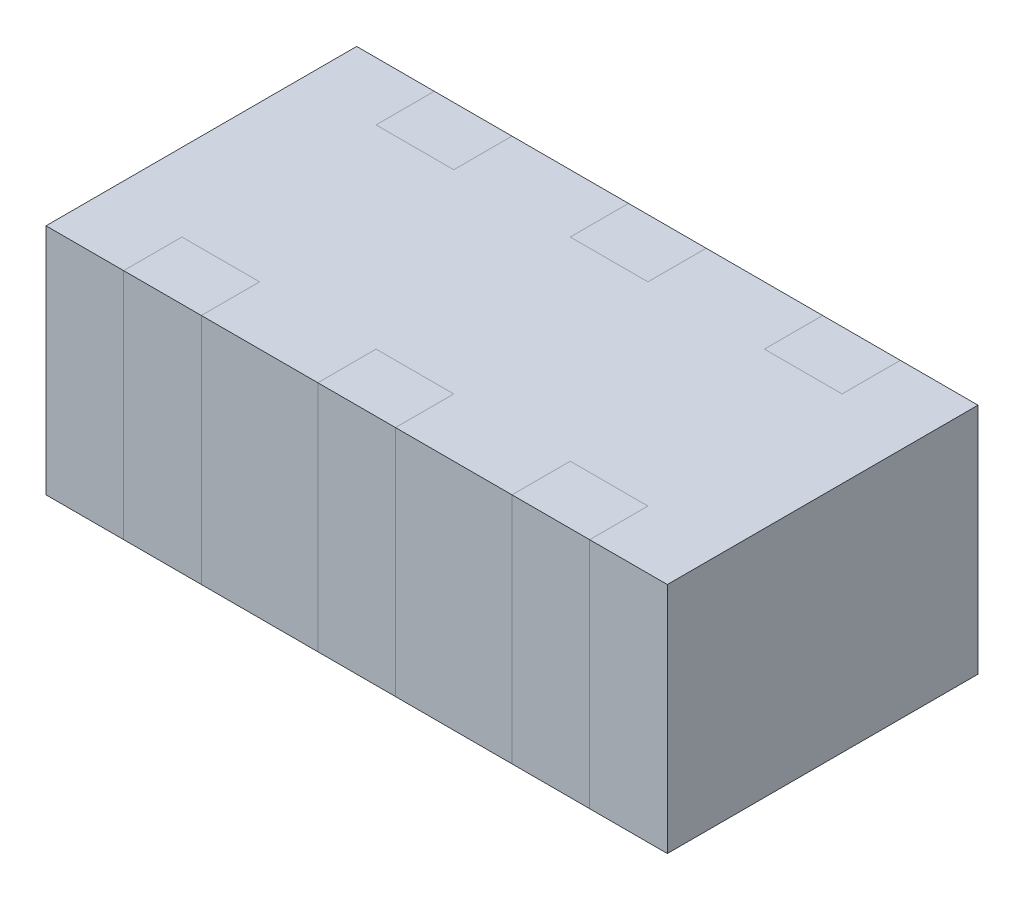
from build123d import *

# Parameters (mm, degrees)
SKETCH1_W             = 1.6
SKETCH1_H             = 0.8
BOSS_EXTRUDE1_DEPTH   = 0.6
SKETCH2_W             = 0.2
SKETCH2_H             = 0.15
CUT_EXTRUDE1_DEPTH    = 0.6
SKETCH2_2_W           = 0.2
SKETCH2_2_H           = 0.15
BOSS_EXTRUDE2_DEPTH   = 0.6
BOSS_EXTRUDE2_2_DEPTH = 0.6
BOSS_EXTRUDE2_3_DEPTH = 0.6


with BuildPart() as part:
    # Sketch1 → Boss-Extrude1 (new body)
    with BuildSketch(Plane(origin=(0, 0, 0), x_dir=(1, 0, 0), z_dir=(0, 1, 0))):
        Rectangle(SKETCH1_W, SKETCH1_H)
    extrude(amount=BOSS_EXTRUDE1_DEPTH)

    # Sketch2 → Cut-Extrude1 (cut)
    with BuildSketch(Plane(origin=(0, 0.6, 0), x_dir=(1, 0, 0), z_dir=(0, 1, 0))):
        with Locations((-0.5, -0.325)):
            Rectangle(SKETCH2_W, SKETCH2_H)
        with Locations((0.5, -0.325)):
            Rectangle(SKETCH2_W, SKETCH2_H)
        with Locations((0, -0.325)):
            Rectangle(SKETCH2_W, SKETCH2_H)
    cut_extrude1 = extrude(amount=-CUT_EXTRUDE1_DEPTH, mode=Mode.SUBTRACT)

    # Mirror1: Cut-Extrude1 across plane
    add(cut_extrude1.mirror(Plane.XY), mode=Mode.SUBTRACT)


with BuildPart() as body_2:
    # Sketch2<2> → Boss-Extrude2 (new body)
    with BuildSketch(Plane(origin=(0, 0.6, 0), x_dir=(1, 0, 0), z_dir=(0, 1, 0))):
        with Locations((-0.5, -0.325)):
            Rectangle(SKETCH2_2_W, SKETCH2_2_H)
    extrude(amount=-BOSS_EXTRUDE2_DEPTH)


with BuildPart() as body_3:
    # Sketch2<2> → Boss-Extrude2 2 (new body)
    with BuildSketch(Plane(origin=(0, 0.6, 0), x_dir=(1, 0, 0), z_dir=(0, 1, 0))):
        with Locations((0.5, -0.325)):
            Rectangle(SKETCH2_2_W, SKETCH2_2_H)
    extrude(amount=-BOSS_EXTRUDE2_2_DEPTH)


with BuildPart() as body_4:
    # Sketch2<2> → Boss-Extrude2 3 (new body)
    with BuildSketch(Plane(origin=(0, 0.6, 0), x_dir=(1, 0, 0), z_dir=(0, 1, 0))):
        with Locations((0, -0.325)):
            Rectangle(SKETCH2_2_W, SKETCH2_2_H)
    extrude(amount=-BOSS_EXTRUDE2_3_DEPTH)


with BuildPart() as body_5:
    # Mirror3: mirrored copy
    add(body_2.part.mirror(Plane.XY))


with BuildPart() as body_6:
    # Mirror3 2: mirrored copy
    add(body_4.part.mirror(Plane.XY))


with BuildPart() as body_7:
    # Mirror3 3: mirrored copy
    add(body_3.part.mirror(Plane.XY))


solid = Compound([part.part, body_2.part, body_3.part, body_4.part, body_5.part, body_6.part, body_7.part])
